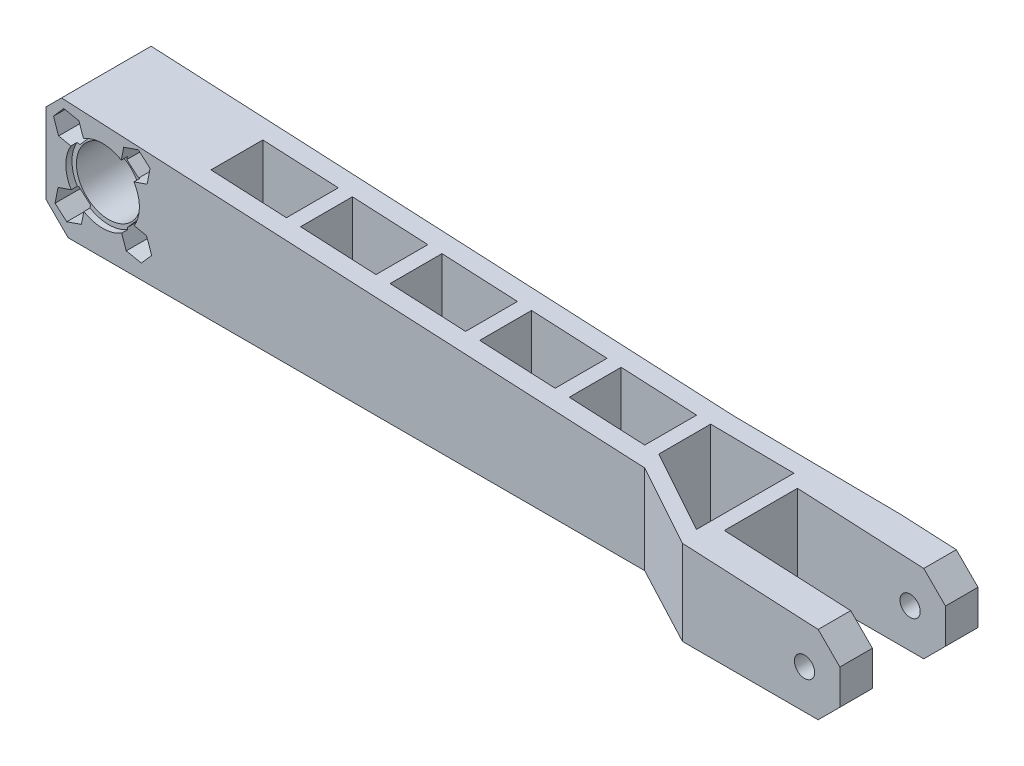
from build123d import *

# Parameters (mm, degrees)
SKETCH_1_W           = 16
SKETCH_1_H           = 11
EXTRUDE_1_DEPTH      = 25
SKETCH_2_OUTSIDE_W   = 215.706
SKETCH_2_OUTSIDE_H   = 63.306
SKETCH_2_OUTSIDE_R   = 2.15
SKETCH_2_OUTSIDE_R_2 = 6.85
CUT_EXTRUDE_1_DEPTH  = 182.533054841
SKETCH_3_R           = 7.8
CUT_EXTRUDE_2_DEPTH  = 1.3
SKETCH_4_R           = 7.85
CUT_EXTRUDE_3_DEPTH  = 1.3
CUT_EXTRUDE_5_DEPTH  = 7
SKETCH_5_3_R         = 1.50558517
CUT_EXTRUDE_6_DEPTH  = 181.299334441


with BuildPart() as part:
    # 草图1 → 凸台-拉伸1 (new body)
    with BuildSketch(Plane(origin=(0, 0, 0), x_dir=(1, 0, 0), z_dir=(0, 1, 0))):
        Polygon((0, 0), (0, 19), (127, 19), (161, 20.3), (177.4, 20.3), (177.4, 13.4), (146, 13.4), (146, -2.1), (177.4, -2.1), (177.4, -9), (144, -9), (127, 0), align=None)
        with Locations((39, 9.5)):
            Rectangle(SKETCH_1_W, SKETCH_1_H, mode=Mode.SUBTRACT)
        Polygon((126, 15), (126, 4), (143, -5), (143, 15.65), align=None, mode=Mode.SUBTRACT)
        with Locations((58, 9.5)):
            Rectangle(SKETCH_1_W, SKETCH_1_H, mode=Mode.SUBTRACT)
        with Locations((77, 9.5)):
            Rectangle(SKETCH_1_W, SKETCH_1_H, mode=Mode.SUBTRACT)
        with Locations((96, 9.5)):
            Rectangle(SKETCH_1_W, SKETCH_1_H, mode=Mode.SUBTRACT)
        with Locations((115, 9.5)):
            Rectangle(SKETCH_1_W, SKETCH_1_H, mode=Mode.SUBTRACT)
    extrude(amount=EXTRUDE_1_DEPTH)

    # 草图2 outside → 切除-拉伸1 (cut, through all)
    # profile 1 of 3: a face of its own
    with BuildSketch(Plane.XY.offset(9)):
        with Locations((88.7, 12.5)):
            Rectangle(SKETCH_2_OUTSIDE_W, SKETCH_2_OUTSIDE_H)
        Polygon((0, 21.701223904), (3.298776096, 25), (172.796734854, 16.606530291), (177.4, 12.003265146), (177.4, 4.603265146), (172.796734854, 0), (4.701223904, 0), (0, 4.701223904), align=None, mode=Mode.SUBTRACT)
    # profile 2 of 3: a face of its own
    with BuildSketch(Plane.XY.offset(9)):
        with Locations((169.9, 8.303265146)):
            Circle(SKETCH_2_OUTSIDE_R)
    # profile 3 of 3: a face of its own
    with BuildSketch(Plane.XY.offset(9)):
        with Locations((12, 13.201223904)):
            Circle(SKETCH_2_OUTSIDE_R_2)
    extrude(amount=-CUT_EXTRUDE_1_DEPTH, mode=Mode.SUBTRACT)

    # 草图3 → 切除-拉伸2 (cut)
    with BuildSketch(Plane.XY):
        with Locations((12, 13.201223904)):
            Circle(SKETCH_3_R)
    extrude(amount=-CUT_EXTRUDE_2_DEPTH, mode=Mode.SUBTRACT)

    # 草图4 → 切除-拉伸3 (cut)
    with BuildSketch(Plane(origin=(0, 0, -19), x_dir=(-1, 0, 0), z_dir=(0, 0, -1))):
        with Locations((-12, 13.201223904)):
            Circle(SKETCH_4_R)
    extrude(amount=-CUT_EXTRUDE_3_DEPTH, mode=Mode.SUBTRACT)

    # 草图5 → 切除-拉伸5 (cut)
    with BuildSketch(Plane.XY):
        Polygon((15.855153168, 19.304745085), (18.337708884, 17.144440218), (21.449865637, 18.214244102), (22.079466672, 21.444352852), (19.596910956, 23.604657718), (16.484754204, 22.534853834), align=None)
        Polygon((5.896478819, 17.056377072), (8.056783686, 19.538932788), (6.986979802, 22.651089541), (3.756871052, 23.280690576), (1.596566186, 20.79813486), (2.66637007, 17.685978108), align=None)
        Polygon((18.103521181, 9.346070736), (15.943216314, 6.86351502), (17.013020198, 3.751358267), (20.243128948, 3.121757232), (22.403433814, 5.604312948), (21.33362993, 8.7164697), align=None)
        Polygon((8.144846832, 7.097702723), (5.662291116, 9.25800759), (2.550134363, 8.188203706), (1.920533328, 4.958094956), (4.403089044, 2.79779009), (7.515245796, 3.867593974), align=None)
    extrude(amount=-CUT_EXTRUDE_5_DEPTH, mode=Mode.SUBTRACT)

    # 草图5<3> → 切除-拉伸6 (cut, through all)
    with BuildSketch(Plane.XY):
        with Locations((4.826674936, 20.168533824)):
            Circle(SKETCH_5_3_R)
        with Locations((18.96730992, 20.374548968)):
            Circle(SKETCH_5_3_R)
        with Locations((19.173325064, 6.233913984)):
            Circle(SKETCH_5_3_R)
        with Locations((5.03269008, 6.02789884)):
            Circle(SKETCH_5_3_R)
    extrude(amount=-CUT_EXTRUDE_6_DEPTH, mode=Mode.SUBTRACT)


solid = part.part
